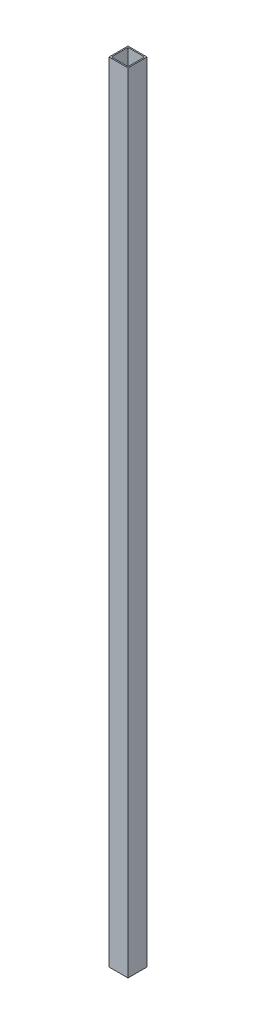
from build123d import *

# Parameters (mm, degrees)
SKETCH1_W           = 25.4
SKETCH1_H           = 25.4
SKETCH1_W_2         = 22.225
SKETCH1_H_2         = 22.225
BOSS_EXTRUDE1_DEPTH = 1054.1


with BuildPart() as part:
    # Sketch1 → Boss-Extrude1 (new body)
    with BuildSketch(Plane(origin=(0, 0, 0), x_dir=(1, 0, 0), z_dir=(0, 1, 0))):
        Rectangle(SKETCH1_W, SKETCH1_H)
        Rectangle(SKETCH1_W_2, SKETCH1_H_2, mode=Mode.SUBTRACT)
    extrude(amount=BOSS_EXTRUDE1_DEPTH)


solid = part.part
